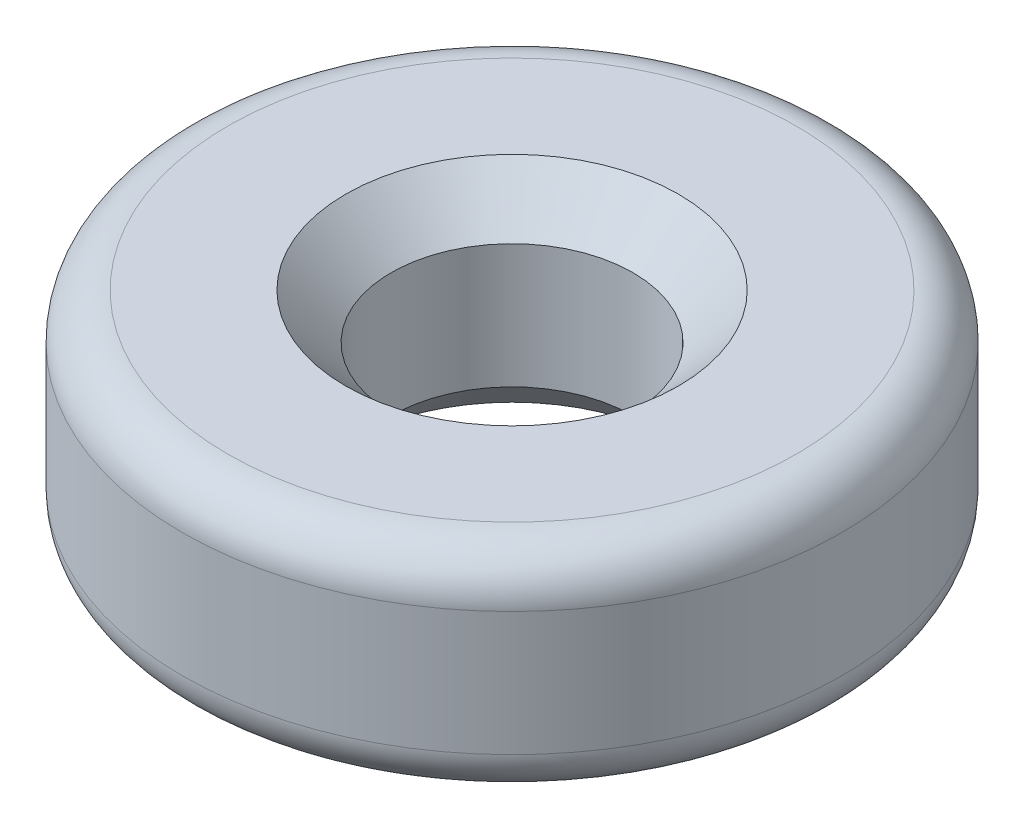
from build123d import *

# Parameters (mm, degrees)
SKETCH1_R           = 2.7686
SKETCH1_R_2         = 1.016
BOSS_EXTRUDE1_DEPTH = 1.8034
FILLET1_R           = 0.381
CHAMFER1_SIZE       = 0.381


with BuildPart() as part:
    # Sketch1 → Boss-Extrude1 (new body)
    with BuildSketch(Plane(origin=(0, 0, 0), x_dir=(1, 0, 0), z_dir=(0, 1, 0))):
        with Locations(Location((0, 0, 0), (0, 0, 270))):
            Circle(SKETCH1_R)
        with Locations(Location((0, 0, 0), (0, 0, 270))):
            Circle(SKETCH1_R_2, mode=Mode.SUBTRACT)
    extrude(amount=BOSS_EXTRUDE1_DEPTH)

    # Fillet1
    fillet1_edges = [part.edges().sort_by_distance(p)[0] for p in [
        (0, 0, -2.7686),
        (0, 1.8034, -2.7686),
    ]]
    fillet(fillet1_edges, radius=FILLET1_R)

    # Chamfer1
    chamfer1_edges = [part.edges().sort_by_distance(p)[0] for p in [
        (0, 0, -1.016),
        (0, 1.8034, -1.016),
    ]]
    chamfer(chamfer1_edges, length=CHAMFER1_SIZE)


solid = part.part
